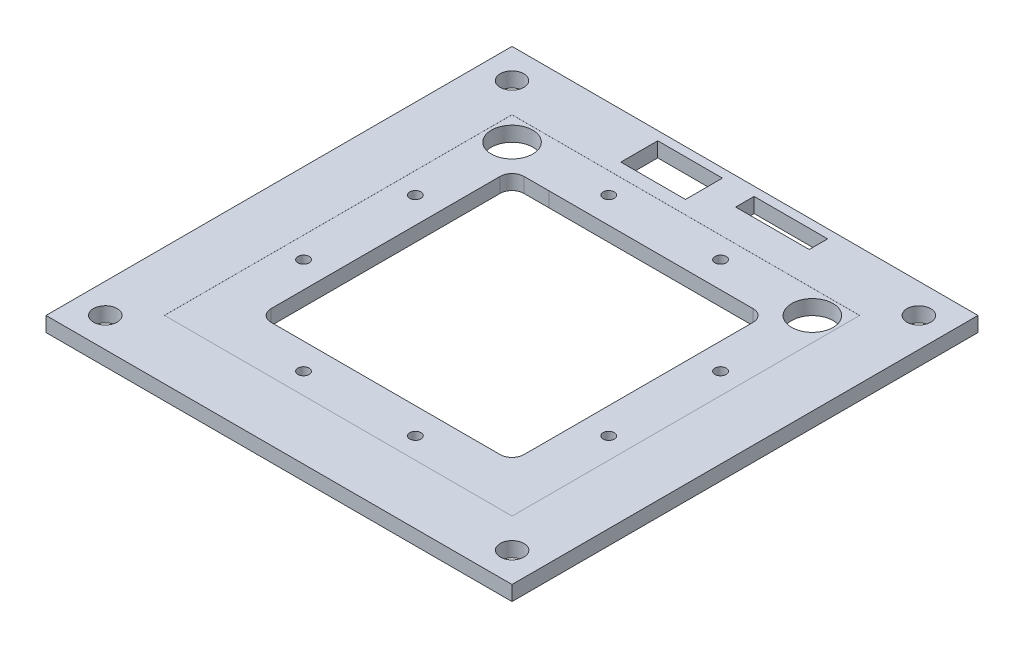
from build123d import *

# Parameters (mm, degrees)
SKETCH1_W           = 200.025
SKETCH1_H           = 200.025
SKETCH1_R           = 5.08
SKETCH1_W_2         = 27.758924323
SKETCH1_H_2         = 15.850492031
SKETCH1_W_3         = 31.563171913
SKETCH1_H_3         = 7.913427648
BOSS_EXTRUDE1_DEPTH = 6.35
FILLET1_R           = 5.08
SKETCH3_R           = 2.4
CUT_EXTRUDE1_DEPTH  = 142.598203764
SKETCH4_W           = 200.025
SKETCH4_H           = 200.025
SKETCH4_R           = 5.08
SKETCH4_W_2         = 149.225
SKETCH4_H_2         = 149.17772653
SKETCH4_W_3         = 27.758924323
SKETCH4_H_3         = 15.850492031
SKETCH4_W_4         = 31.563171913
SKETCH4_H_4         = 7.913427648
BOSS_EXTRUDE2_DEPTH = 0.0254
SKETCH5_R           = 8.89
CUT_EXTRUDE2_DEPTH  = 142.598203764


with BuildPart() as part:
    # Sketch1 → Boss-Extrude1 (new body)
    with BuildSketch(Plane(origin=(0, 0, 0), x_dir=(1, 0, 0), z_dir=(0, 1, 0))):
        with Locations((0, -0.023636735)):
            Rectangle(SKETCH1_W, SKETCH1_H)
        with Locations(Location((-87.3125, 87.288863265, 0), (0, 0, 270))):
            Circle(SKETCH1_R, mode=Mode.SUBTRACT)
        with Locations(Location((87.3125, 87.288863265, 0), (0, 0, 90))):
            Circle(SKETCH1_R, mode=Mode.SUBTRACT)
        with Locations(Location((-87.3125, -87.288863265, 0), (0, 0, 90))):
            Circle(SKETCH1_R, mode=Mode.SUBTRACT)
        with Locations(Location((87.3125, -87.288863265, 0), (0, 0, 270))):
            Circle(SKETCH1_R, mode=Mode.SUBTRACT)
        with Locations((-19.766444167, 88.253617249)):
            Rectangle(SKETCH1_W_2, SKETCH1_H_2, mode=Mode.SUBTRACT)
        with Locations((23.505506165, 92.222149441)):
            Rectangle(SKETCH1_W_3, SKETCH1_H_3, mode=Mode.SUBTRACT)
        Polygon((54.27, -38.5), (54.27, 38.5), (54.293636735, 54.27), (38.5, 54.27), (-38.5, 54.27), (-54.27, 54.246363265), (-54.27, 38.5), (-54.27, -38.5), (-54.27, -54.293636735), (-42.77, -54.27), (-38.5, -54.27), (38.5, -54.27), (42.77, -54.27), (54.246363265, -54.27), (54.27, -42.77), align=None, mode=Mode.SUBTRACT)
    extrude(amount=BOSS_EXTRUDE1_DEPTH)

    # Fillet1
    fillet1_edges = [part.edges().sort_by_distance(p)[0] for p in [
        (-54.27, 3.175, -54.246363265),
        (-54.27, 3.175, 54.293636735),
        (54.246363265, 3.175, 54.27),
        (54.293636735, 3.175, -54.27),
    ]]
    fillet(fillet1_edges, radius=FILLET1_R)

    # Sketch3 → Cut-Extrude1 (cut, through all)
    with BuildSketch(Plane.XZ):
        with Locations(Location((-24, 65.5, 0), (0, 0, 270))):
            Circle(SKETCH3_R)
        with Locations(Location((24, 65.5, 0), (0, 0, 270))):
            Circle(SKETCH3_R)
        with Locations(Location((65.5, 24, 0), (0, 0, 270))):
            Circle(SKETCH3_R)
        with Locations(Location((65.5, -24, 0), (0, 0, 270))):
            Circle(SKETCH3_R)
        with Locations(Location((24, -65.5, 0), (0, 0, 270))):
            Circle(SKETCH3_R)
        with Locations(Location((-24, -65.5, 0), (0, 0, 270))):
            Circle(SKETCH3_R)
        with Locations(Location((-65.5, -24, 0), (0, 0, 270))):
            Circle(SKETCH3_R)
        with Locations(Location((-65.5, 24, 0), (0, 0, 270))):
            Circle(SKETCH3_R)
    extrude(amount=-CUT_EXTRUDE1_DEPTH, mode=Mode.SUBTRACT)

    # Sketch4 → Boss-Extrude2 (add)
    with BuildSketch(Plane(origin=(0, 6.35, 0), x_dir=(1, 0, 0), z_dir=(0, 1, 0))):
        with Locations((0, -0.023636735)):
            Rectangle(SKETCH4_W, SKETCH4_H)
        with Locations(Location((-87.3125, 87.288863265, 0), (0, 0, 270))):
            Circle(SKETCH4_R, mode=Mode.SUBTRACT)
        with Locations(Location((87.3125, 87.288863265, 0), (0, 0, 90))):
            Circle(SKETCH4_R, mode=Mode.SUBTRACT)
        with Locations(Location((87.3125, -87.288863265, 0), (0, 0, 270))):
            Circle(SKETCH4_R, mode=Mode.SUBTRACT)
        with Locations(Location((-87.3125, -87.288863265, 0), (0, 0, 90))):
            Circle(SKETCH4_R, mode=Mode.SUBTRACT)
        Rectangle(SKETCH4_W_2, SKETCH4_H_2, mode=Mode.SUBTRACT)
        with Locations((-19.766444167, 88.253617249)):
            Rectangle(SKETCH4_W_3, SKETCH4_H_3, mode=Mode.SUBTRACT)
        with Locations((23.505506165, 92.222149441)):
            Rectangle(SKETCH4_W_4, SKETCH4_H_4, mode=Mode.SUBTRACT)
    extrude(amount=BOSS_EXTRUDE2_DEPTH)

    # Sketch5 → Cut-Extrude2 (cut, through all)
    with BuildSketch(Plane(origin=(0, 6.35, 0), x_dir=(1, 0, 0), z_dir=(0, 1, 0))):
        with Locations(Location((-64.4525, 64.455022357, 0), (0, 0, 270))):
            Circle(SKETCH5_R)
        with Locations(Location((64.4525, 64.455022357, 0), (0, 0, 90))):
            Circle(SKETCH5_R)
    extrude(amount=-CUT_EXTRUDE2_DEPTH, mode=Mode.SUBTRACT)


solid = part.part
